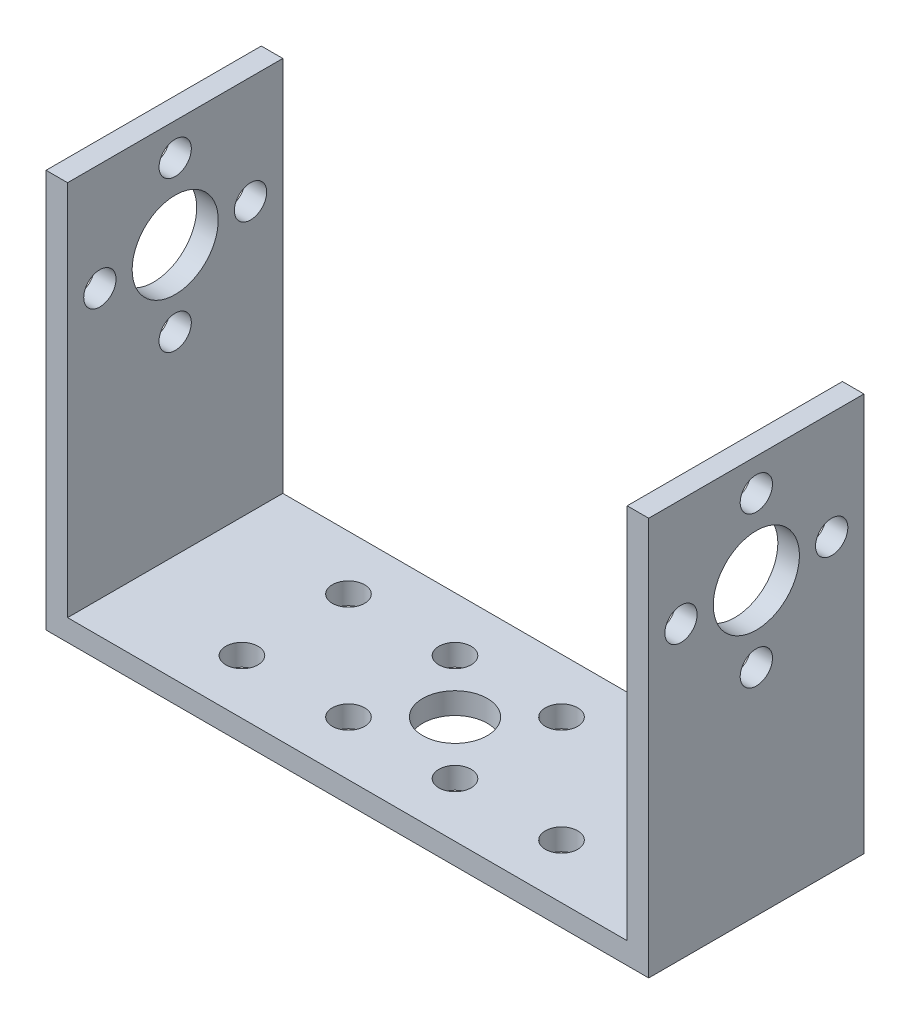
from build123d import *

# Parameters (mm, degrees)
SKETCH1_W           = 56
SKETCH1_H           = 20
BOSS_EXTRUDE1_DEPTH = 2
SKETCH2_W           = 2
SKETCH2_H           = 20
BOSS_EXTRUDE2_DEPTH = 35
SKETCH3_R           = 4
SKETCH3_R_2         = 1.5
CUT_EXTRUDE1_DEPTH  = 70.744065851
SKETCH4_R           = 1.5
SKETCH4_R_2         = 3
CUT_EXTRUDE2_DEPTH  = 67.983988806


with BuildPart() as part:
    # Sketch1 → Boss-Extrude1 (new body)
    with BuildSketch(Plane(origin=(0, 0, 0), x_dir=(1, 0, 0), z_dir=(0, 1, 0))):
        with Locations((25.875968992, 8.953488372)):
            Rectangle(SKETCH1_W, SKETCH1_H)
    extrude(amount=BOSS_EXTRUDE1_DEPTH)

    # Sketch2 → Boss-Extrude2 (add)
    with BuildSketch(Plane(origin=(0, 2, 0), x_dir=(1, 0, 0), z_dir=(0, 1, 0))):
        with Locations((-1.124031008, 8.953488372)):
            Rectangle(SKETCH2_W, SKETCH2_H)
        with Locations((52.875968992, 8.953488372)):
            Rectangle(SKETCH2_W, SKETCH2_H)
    extrude(amount=BOSS_EXTRUDE2_DEPTH)

    # Sketch3 → Cut-Extrude1 (cut, through all)
    with BuildSketch(Plane.ZY.offset(2.124031008)):
        with Locations((-8.953488372, 27)):
            Circle(SKETCH3_R)
        with Locations((-15.953488372, 27)):
            Circle(SKETCH3_R_2)
        with Locations((-1.953488372, 27)):
            Circle(SKETCH3_R_2)
        with Locations((-8.953488372, 34)):
            Circle(SKETCH3_R_2)
        with Locations((-8.953488372, 20)):
            Circle(SKETCH3_R_2)
    extrude(amount=-CUT_EXTRUDE1_DEPTH, mode=Mode.SUBTRACT)

    # Sketch4 → Cut-Extrude2 (cut, through all)
    with BuildSketch(Plane(origin=(0, 2, 0), x_dir=(1, 0, 0), z_dir=(0, 1, 0))):
        with Locations(Location((30.825468992, 4.003988372, 0), (0, 0, 270))):
            Circle(SKETCH4_R)
        with Locations(Location((20.926468992, 4.003988372, 0), (0, 0, 270))):
            Circle(SKETCH4_R)
        with Locations(Location((30.825468992, 13.902988372, 0), (0, 0, 270))):
            Circle(SKETCH4_R)
        with Locations(Location((20.926468992, 13.902988372, 0), (0, 0, 270))):
            Circle(SKETCH4_R)
        with Locations(Location((25.875968992, 8.953488372, 0), (0, 0, 270))):
            Circle(SKETCH4_R_2)
        with Locations(Location((40.724468992, 4.003988372, 0), (0, 0, 270))):
            Circle(SKETCH4_R)
        with Locations(Location((40.724468992, 13.902988372, 0), (0, 0, 270))):
            Circle(SKETCH4_R)
        with Locations(Location((11.027468992, 13.902988372, 0), (0, 0, 270))):
            Circle(SKETCH4_R)
        with Locations(Location((11.027468992, 4.003988372, 0), (0, 0, 270))):
            Circle(SKETCH4_R)
    extrude(amount=-CUT_EXTRUDE2_DEPTH, mode=Mode.SUBTRACT)


solid = part.part
